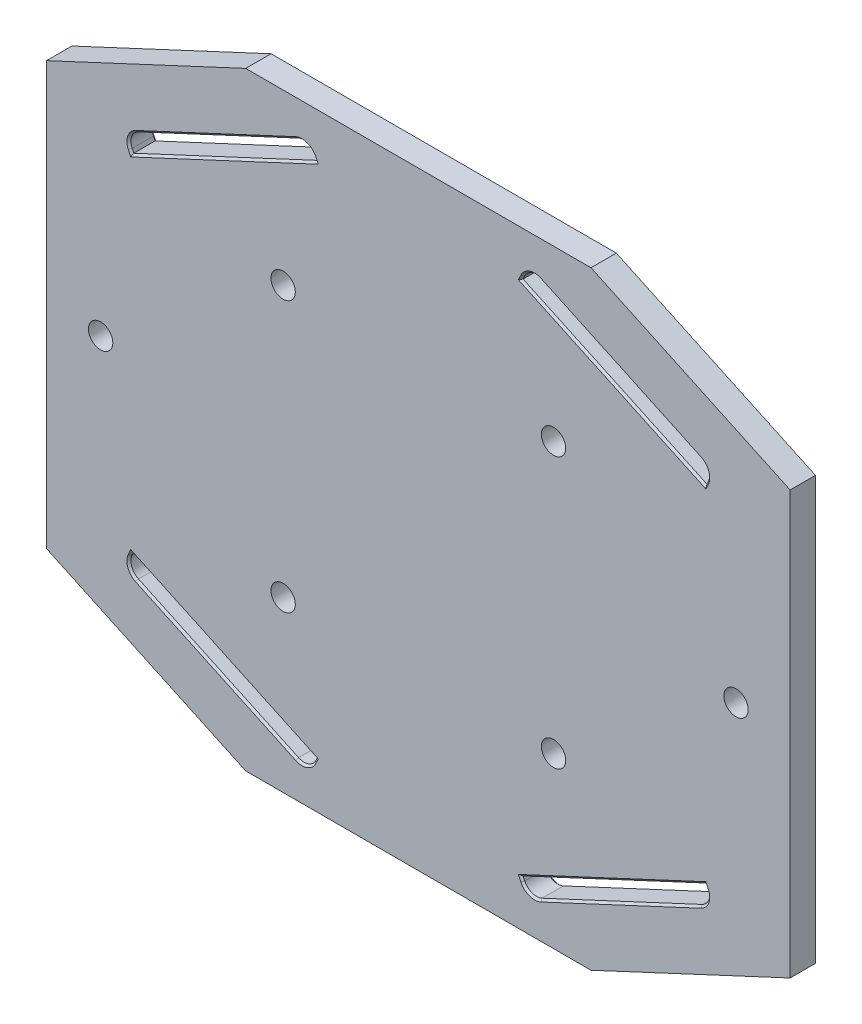
from build123d import *

# Parameters (mm, degrees)
SKETCH3_R           = 4.572
BOSS_EXTRUDE1_DEPTH = 9.525
FILLET1_R           = 4.92
FILLET2_R           = 4.92
CHAMFER1_SIZE       = 0.762
CHAMFER2_SIZE       = 0.762
FILLET3_R           = 4.92
FILLET4_R           = 4.92
FILLET5_R           = 4.92
FILLET6_R           = 4.92
FILLET7_R           = 4.92
FILLET8_R           = 4.92
CHAMFER3_SIZE       = 0.762
CHAMFER4_SIZE       = 0.762
CHAMFER5_SIZE       = 0.762


with BuildPart() as part:
    # Sketch3 → Boss-Extrude1 (new body)
    with BuildSketch(Plane.XY):
        Polygon((64.86807053, -114.3), (-64.86807053, -114.3), (-139.7, -79.405298214), (-139.7, 79.405298214), (-64.86807053, 114.3), (64.86807053, 114.3), (139.7, 79.405298214), (139.7, -79.405298214), align=None)
        with Locations(Location((-50.8, 50.8, 0), (0, 0, 180))):
            Circle(SKETCH3_R, mode=Mode.SUBTRACT)
        with Locations(Location((50.8, 50.8, 0), (0, 0, 180))):
            Circle(SKETCH3_R, mode=Mode.SUBTRACT)
        with Locations(Location((50.8, -50.8, 0), (0, 0, 180))):
            Circle(SKETCH3_R, mode=Mode.SUBTRACT)
        with Locations(Location((-50.8, -50.8, 0), (0, 0, 180))):
            Circle(SKETCH3_R, mode=Mode.SUBTRACT)
        with Locations(Location((-119.38, 0, 0), (0, 0, 180))):
            Circle(SKETCH3_R, mode=Mode.SUBTRACT)
        with Locations(Location((119.38, 0, 0), (0, 0, 180))):
            Circle(SKETCH3_R, mode=Mode.SUBTRACT)
        Polygon((-107.675595872, 64.911434008), (-38.6149425, 97.114945552), (-41.298568462, 102.87), (-110.359221834, 70.666488455), align=None, mode=Mode.SUBTRACT)
        Polygon((38.6149425, 97.114945552), (41.298568462, 102.87), (110.359221834, 70.666488455), (107.675595872, 64.911434008), align=None, mode=Mode.SUBTRACT)
        Polygon((-38.6149425, -97.114945552), (-41.298568462, -102.87), (-110.359221834, -70.666488455), (-107.675595872, -64.911434008), align=None, mode=Mode.SUBTRACT)
        Polygon((107.675595872, -64.911434008), (38.6149425, -97.114945552), (41.298568462, -102.87), (110.359221834, -70.666488455), align=None, mode=Mode.SUBTRACT)
    extrude(amount=BOSS_EXTRUDE1_DEPTH)

    # Fillet1
    fillet1_edges = [part.edges().sort_by_distance(p)[0] for p in [
        (-41.298568462, 102.87, 4.7625),
    ]]
    fillet(fillet1_edges, radius=FILLET1_R)

    # Fillet2
    fillet2_edges = [part.edges().sort_by_distance(p)[0] for p in [
        (-110.359221834, 70.666488455, 4.7625),
    ]]
    fillet(fillet2_edges, radius=FILLET2_R)

    # Chamfer1
    chamfer1_edges = [part.edges().sort_by_distance(p)[0] for p in [
        (-75.828895148, 86.768244228, 9.525),
        (-41.995581821, 100.954971534, 9.525),
        (-107.977767929, 65.559444075, 9.525),
        (-108.444193368, 69.969475096, 9.525),
        (-73.145269186, 81.01318978, 9.525),
        (-38.917114557, 97.76295562, 9.525),
    ]]
    chamfer(chamfer1_edges, length=CHAMFER1_SIZE)

    # Chamfer2
    chamfer2_edges = [part.edges().sort_by_distance(p)[0] for p in [
        (-75.828895148, 86.768244228, 0),
        (-41.995581821, 100.954971534, 0),
        (-107.977767929, 65.559444075, 0),
        (-108.444193368, 69.969475096, 0),
        (-73.145269186, 81.01318978, 0),
        (-38.917114557, 97.76295562, 0),
    ]]
    chamfer(chamfer2_edges, length=CHAMFER2_SIZE)

    # Fillet3
    fillet3_edges = [part.edges().sort_by_distance(p)[0] for p in [
        (41.298568462, 102.87, 4.7625),
    ]]
    fillet(fillet3_edges, radius=FILLET3_R)

    # Fillet4
    fillet4_edges = [part.edges().sort_by_distance(p)[0] for p in [
        (110.359221834, 70.666488455, 4.7625),
    ]]
    fillet(fillet4_edges, radius=FILLET4_R)

    # Fillet5
    fillet5_edges = [part.edges().sort_by_distance(p)[0] for p in [
        (110.359221834, -70.666488455, 4.7625),
    ]]
    fillet(fillet5_edges, radius=FILLET5_R)

    # Fillet6
    fillet6_edges = [part.edges().sort_by_distance(p)[0] for p in [
        (41.298568462, -102.87, 4.7625),
    ]]
    fillet(fillet6_edges, radius=FILLET6_R)

    # Fillet7
    fillet7_edges = [part.edges().sort_by_distance(p)[0] for p in [
        (-41.298568462, -102.87, 4.7625),
    ]]
    fillet(fillet7_edges, radius=FILLET7_R)

    # Fillet8
    fillet8_edges = [part.edges().sort_by_distance(p)[0] for p in [
        (-110.359221834, -70.666488455, 4.7625),
    ]]
    fillet(fillet8_edges, radius=FILLET8_R)

    # Chamfer3
    chamfer3_edges = [part.edges().sort_by_distance(p)[0] for p in [
        (38.917114557, 97.76295562, 0),
        (38.917114557, 97.76295562, 9.525),
        (41.995581821, 100.954971534, 0),
        (41.995581821, 100.954971534, 9.525),
        (75.828895148, 86.768244228, 9.525),
        (75.828895148, 86.768244228, 0),
        (108.444193368, 69.969475096, 0),
        (108.444193368, 69.969475096, 9.525),
        (73.145269186, 81.01318978, 0),
        (107.977767929, 65.559444075, 0),
        (73.145269186, 81.01318978, 9.525),
        (107.977767929, 65.559444075, 9.525),
    ]]
    chamfer(chamfer3_edges, length=CHAMFER3_SIZE)

    # Chamfer4
    chamfer4_edges = [part.edges().sort_by_distance(p)[0] for p in [
        (-38.917114557, -97.76295562, 0),
        (-38.917114557, -97.76295562, 9.525),
        (-41.995581821, -100.954971534, 0),
        (-41.995581821, -100.954971534, 9.525),
        (-75.828895148, -86.768244228, 9.525),
        (-75.828895148, -86.768244228, 0),
        (-108.444193368, -69.969475096, 9.525),
        (-108.444193368, -69.969475096, 0),
        (-73.145269186, -81.01318978, 0),
        (-107.977767929, -65.559444075, 0),
        (-73.145269186, -81.01318978, 9.525),
        (-107.977767929, -65.559444075, 9.525),
    ]]
    chamfer(chamfer4_edges, length=CHAMFER4_SIZE)

    # Chamfer5
    chamfer5_edges = [part.edges().sort_by_distance(p)[0] for p in [
        (107.977767929, -65.559444075, 0),
        (107.977767929, -65.559444075, 9.525),
        (108.444193368, -69.969475096, 0),
        (108.444193368, -69.969475096, 9.525),
        (75.828895148, -86.768244228, 9.525),
        (75.828895148, -86.768244228, 0),
        (41.995581821, -100.954971534, 9.525),
        (41.995581821, -100.954971534, 0),
        (73.145269186, -81.01318978, 0),
        (38.917114557, -97.76295562, 0),
        (73.145269186, -81.01318978, 9.525),
        (38.917114557, -97.76295562, 9.525),
    ]]
    chamfer(chamfer5_edges, length=CHAMFER5_SIZE)


solid = part.part
